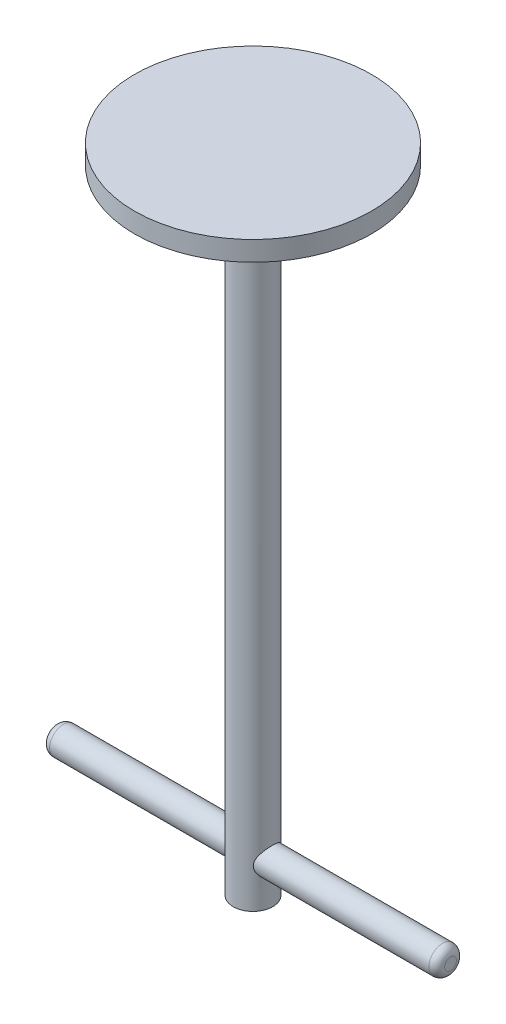
from build123d import *

# Parameters (mm, degrees)
SKETCH1_R           = 6.35
BOSS_EXTRUDE1_DEPTH = 203.2
CHAMFER1_SIZE       = 2.54
SKETCH3_R           = 38.1
BOSS_EXTRUDE2_DEPTH = 6.35
SKETCH4_R           = 4.445
BOSS_EXTRUDE3_DEPTH = 63.5
FILLET2_R           = 2.54


with BuildPart() as part:
    # Sketch1 → Boss-Extrude1 (new body)
    with BuildSketch(Plane(origin=(0, 0, 0), x_dir=(1, 0, 0), z_dir=(0, 1, 0))):
        with Locations(Location((0, 0, 0), (0, 0, 270))):
            Circle(SKETCH1_R)
    extrude(amount=BOSS_EXTRUDE1_DEPTH)

    # Chamfer1
    chamfer1_edges = [part.edges().sort_by_distance(p)[0] for p in [
        (0, 203.2, -6.35),
    ]]
    chamfer(chamfer1_edges, length=CHAMFER1_SIZE)

    # Sketch3 → Boss-Extrude2 (add)
    with BuildSketch(Plane(origin=(0, 203.2, 0), x_dir=(1, 0, 0), z_dir=(0, 1, 0))):
        with Locations(Location((0, 0, 0), (0, 0, 270))):
            Circle(SKETCH3_R)
    extrude(amount=BOSS_EXTRUDE2_DEPTH)

    # Sketch4 → Boss-Extrude3 (add, symmetric)
    with BuildSketch(Plane(origin=(0, 0, 0), x_dir=(0, 0, -1), z_dir=(1, 0, 0))):
        with Locations(Location((0, 12.7, 0), (0, 0, 180))):
            Circle(SKETCH4_R)
    extrude(amount=BOSS_EXTRUDE3_DEPTH, both=True)

    # Fillet2
    fillet2_edges = [part.edges().sort_by_distance(p)[0] for p in [
        (-63.5, 12.7, -4.445),
        (63.5, 12.7, -4.445),
    ]]
    fillet(fillet2_edges, radius=FILLET2_R)


solid = part.part
